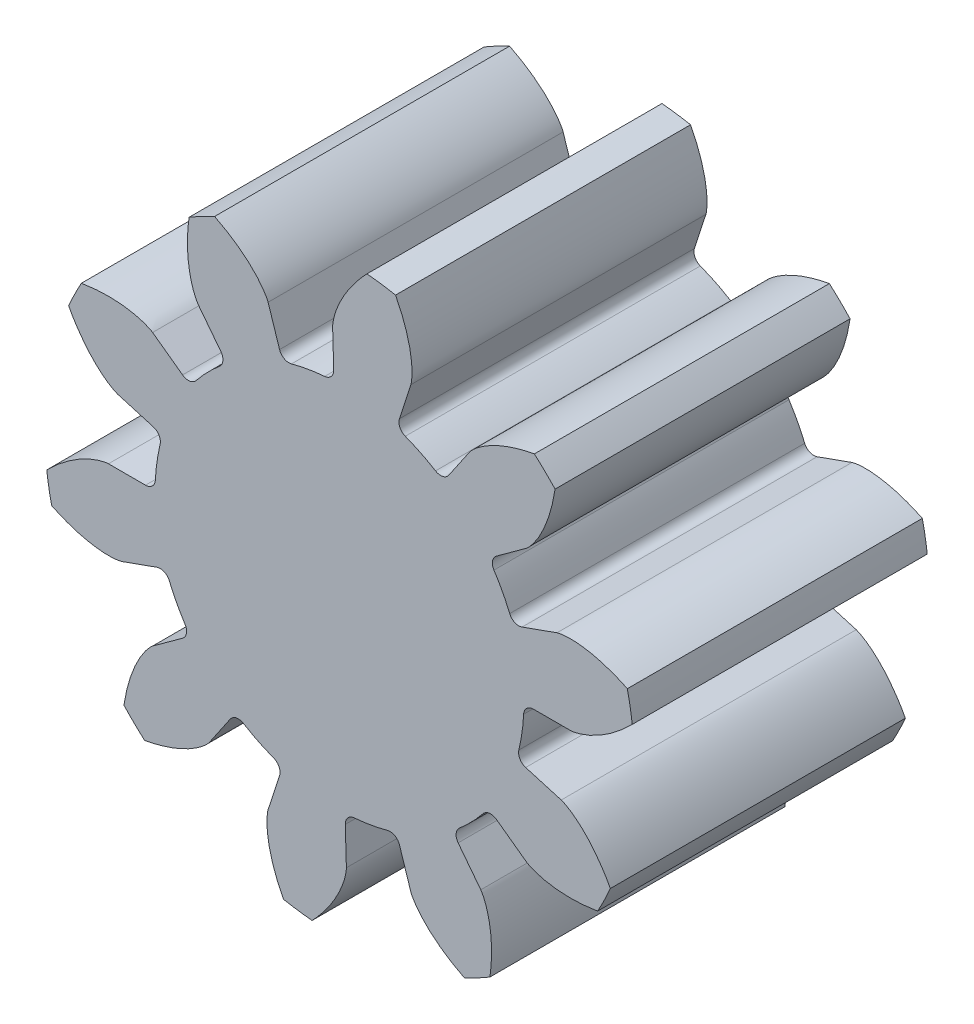
from build123d import *

# Parameters (mm, degrees)
SKETCH1_R                 = 3
BOSS_EXTRUDE1_DEPTH       = 3
CUT_EXTRUDE1_DEPTH        = 6.196152423
FILLET1_R                 = 0.1
FILLET2_R                 = 0.1
CIRPATTERN14_COUNT        = 10
FILLET1_OF_CIRPATTERN14_R = 0.1
FILLET2_OF_CIRPATTERN14_R = 0.1


with BuildPart() as part:
    # Sketch1 → Boss-Extrude1 (new body)
    with BuildSketch(Plane.XY):
        Circle(SKETCH1_R)
    extrude(amount=BOSS_EXTRUDE1_DEPTH)

    # Sketch3 → Cut-Extrude1 (cut, symmetric)
    with BuildSketch(Plane.XY):
        with BuildLine():
            Line((2.349231552, 0), (1.875, 0))
            ThreePointArc((1.875, 0), (1.856081461, -0.265681404), (1.799707617, -0.526001418))
            Line((1.799707617, -0.526001418), (2.254895957, -0.659039534))
            add(Edge.make_bspline(
                [(2.254895957, -0.659039534), (2.25787422, -0.659964984), (2.263412007, -0.662006003), (2.272335221, -0.665647303), (2.28963445, -0.673621098), (2.308733433, -0.683697496), (2.329817981, -0.696108803), (2.351960539, -0.710461339), (2.37055689, -0.723353992), (2.388782848, -0.736785197), (2.406637626, -0.750674073), (2.427896574, -0.768090276), (2.452866607, -0.78979201), (2.48125934, -0.816322919), (2.512498608, -0.847768154), (2.543262663, -0.881223453), (2.572636886, -0.915287409), (2.60124253, -0.95097608), (2.62815616, -0.986405552), (2.654963624, -1.024453254), (2.679127595, -1.060212821), (2.704887132, -1.10160237), (2.723954513, -1.133176247), (2.741793877, -1.165151948), (2.750857671, -1.181773258), (2.754508482, -1.188563427)],
                knots=[0, 0, 0, 0, 0, 0.015083688, 0.02853182, 0.046610139, 0.092110525, 0.119476176, 0.146842496, 0.174208854, 0.201574956, 0.228941013, 0.256307345, 0.307035032, 0.361767352, 0.41649966, 0.471231936, 0.525964282, 0.580696615, 0.635428982, 0.690161387, 0.744893688, 0.799626082, 0.854358408, 0.894707215, 0.894707215, 0.894707215, 0.894707215, 0.894707215], degree=4))
            ThreePointArc((2.754508482, -1.188563427), (2.937986168, -0.606825573), (3, 0))
            ThreePointArc((3, 0), (2.99432743, 0.184399683), (2.977331171, 0.36810202))
            add(Edge.make_bspline(
                [(2.349231552, 0), (2.35234984, 5.2783e-05), (2.358237828, 0.000458305), (2.367824231, 0.00145012), (2.386665714, 0.004250696), (2.407824532, 0.008564551), (2.431544205, 0.014562535), (2.456823984, 0.022126989), (2.478290409, 0.029285016), (2.499552398, 0.037063875), (2.520586503, 0.045386157), (2.545877617, 0.056139136), (2.575933031, 0.069964472), (2.610628452, 0.087464878), (2.649434739, 0.108883719), (2.688348786, 0.132365224), (2.726099561, 0.156820838), (2.763568407, 0.183051539), (2.799340469, 0.209508117), (2.835745132, 0.238507571), (2.868970554, 0.266052361), (2.905306872, 0.298553446), (2.932466133, 0.323510393), (2.958559414, 0.34919753), (2.971922087, 0.362608693), (2.977331171, 0.36810202)],
                knots=[0, 0, 0, 0, 0, 0.015083688, 0.02853182, 0.046610139, 0.092110525, 0.119476176, 0.146842496, 0.174208854, 0.201574956, 0.228941013, 0.256307345, 0.307035032, 0.361767352, 0.41649966, 0.471231936, 0.525964282, 0.580696615, 0.635428982, 0.690161387, 0.744893688, 0.799626082, 0.854358408, 0.894707215, 0.894707215, 0.894707215, 0.894707215, 0.894707215], degree=4))
        make_face()
    cut_extrude1 = extrude(amount=CUT_EXTRUDE1_DEPTH, both=True, mode=Mode.SUBTRACT)

    # Fillet1
    fillet1_edges = [part.edges().sort_by_distance(p)[0] for p in [
        (1.799707617, -0.526001418, 1.5),
    ]]
    fillet(fillet1_edges, radius=FILLET1_R)

    # Fillet2
    fillet2_edges = [part.edges().sort_by_distance(p)[0] for p in [
        (1.875, 0, 1.5),
    ]]
    fillet(fillet2_edges, radius=FILLET2_R)

    # CirPattern14: Cut-Extrude1 ×10 about axis
    cirpattern14_axis = Axis((0, 0, 3), (0, 0, -1))
    for i in range(1, CIRPATTERN14_COUNT):
        add(cut_extrude1.rotate(cirpattern14_axis, i * 360 / CIRPATTERN14_COUNT), mode=Mode.SUBTRACT)

    # Fillet1 of CirPattern14
    fillet1_of_cirpattern14_edges = [part.edges().sort_by_distance(p)[0] for p in [
        (1.146818171, -1.483385682, 1.5),
        (0.055883163, -1.874167034, 1.5),
        (-1.056397315, -1.54908028, 1.5),
        (-1.765169924, -0.63229751, 1.5),
        (-1.799707617, 0.526001418, 1.5),
        (-1.146818171, 1.483385682, 1.5),
        (-0.055883163, 1.874167034, 1.5),
        (1.056397315, 1.54908028, 1.5),
        (1.765169924, 0.63229751, 1.5),
    ]]
    fillet(fillet1_of_cirpattern14_edges, radius=FILLET1_OF_CIRPATTERN14_R)

    # Fillet2 of CirPattern14
    fillet2_of_cirpattern14_edges = [part.edges().sort_by_distance(p)[0] for p in [
        (1.516906864, -1.102097348, 1.5),
        (0.579406864, -1.783230968, 1.5),
        (-0.579406864, -1.783230968, 1.5),
        (-1.516906864, -1.102097348, 1.5),
        (-1.875, 0, 1.5),
        (-1.516906864, 1.102097348, 1.5),
        (-0.579406864, 1.783230968, 1.5),
        (0.579406864, 1.783230968, 1.5),
        (1.516906864, 1.102097348, 1.5),
    ]]
    fillet(fillet2_of_cirpattern14_edges, radius=FILLET2_OF_CIRPATTERN14_R)


solid = part.part
